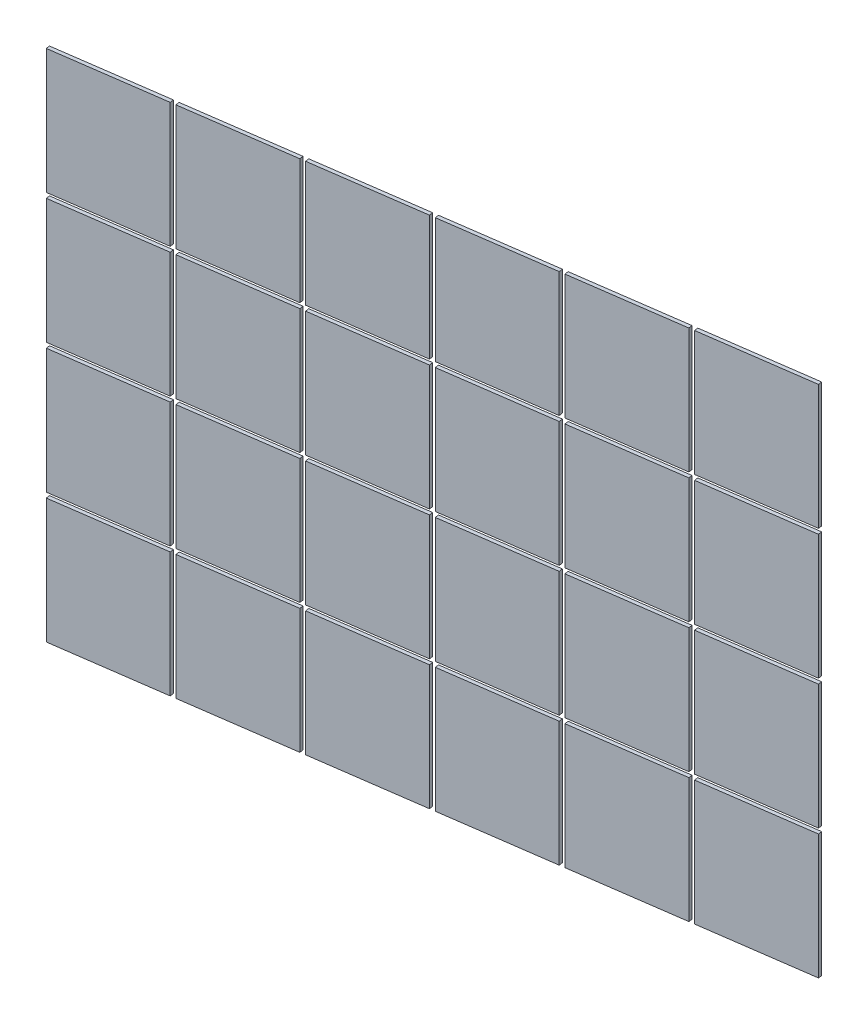
from build123d import *

# Parameters (mm, degrees)
EXTRUDE_START           = 9.3
EXTRUDE_SKETCH_1_W      = 64.666666667
EXTRUDE_SKETCH_1_H      = 73.5
EXTRUDE_1_DEPTH         = 2.2
EXTRUDE_ROTATE_1_ANGLE  = 8
EXTRUDE_SKETCH_2_W      = 64.666666667
EXTRUDE_SKETCH_2_H      = 73.5
EXTRUDE_2_DEPTH         = 2.2
EXTRUDE_ROTATE_2_ANGLE  = 8
EXTRUDE_SKETCH_3_W      = 64.666666667
EXTRUDE_SKETCH_3_H      = 73.5
EXTRUDE_3_DEPTH         = 2.2
EXTRUDE_ROTATE_3_ANGLE  = 8
EXTRUDE_SKETCH_4_W      = 64.666666667
EXTRUDE_SKETCH_4_H      = 73.5
EXTRUDE_4_DEPTH         = 2.2
EXTRUDE_ROTATE_4_ANGLE  = 8
EXTRUDE_SKETCH_5_W      = 64.666666666
EXTRUDE_SKETCH_5_H      = 73.5
EXTRUDE_5_DEPTH         = 2.2
EXTRUDE_ROTATE_5_ANGLE  = 8
EXTRUDE_SKETCH_6_W      = 64.666666666
EXTRUDE_SKETCH_6_H      = 73.5
EXTRUDE_6_DEPTH         = 2.2
EXTRUDE_ROTATE_6_ANGLE  = 8
EXTRUDE_SKETCH_7_W      = 64.666666666
EXTRUDE_SKETCH_7_H      = 73.5
EXTRUDE_7_DEPTH         = 2.2
EXTRUDE_ROTATE_7_ANGLE  = 8
EXTRUDE_SKETCH_8_W      = 64.666666666
EXTRUDE_SKETCH_8_H      = 73.5
EXTRUDE_8_DEPTH         = 2.2
EXTRUDE_ROTATE_8_ANGLE  = 8
EXTRUDE_SKETCH_9_W      = 64.666666667
EXTRUDE_SKETCH_9_H      = 73.5
EXTRUDE_9_DEPTH         = 2.2
EXTRUDE_ROTATE_9_ANGLE  = 8
EXTRUDE_SKETCH_10_W     = 64.666666667
EXTRUDE_SKETCH_10_H     = 73.5
EXTRUDE_10_DEPTH        = 2.2
EXTRUDE_ROTATE_10_ANGLE = 8
EXTRUDE_SKETCH_11_W     = 64.666666667
EXTRUDE_SKETCH_11_H     = 73.5
EXTRUDE_11_DEPTH        = 2.2
EXTRUDE_ROTATE_11_ANGLE = 8
EXTRUDE_SKETCH_12_W     = 64.666666667
EXTRUDE_SKETCH_12_H     = 73.5
EXTRUDE_12_DEPTH        = 2.2
EXTRUDE_ROTATE_12_ANGLE = 8
EXTRUDE_SKETCH_13_W     = 64.666666667
EXTRUDE_SKETCH_13_H     = 73.5
EXTRUDE_13_DEPTH        = 2.2
EXTRUDE_ROTATE_13_ANGLE = 8
EXTRUDE_SKETCH_14_W     = 64.666666667
EXTRUDE_SKETCH_14_H     = 73.5
EXTRUDE_14_DEPTH        = 2.2
EXTRUDE_ROTATE_14_ANGLE = 8
EXTRUDE_SKETCH_15_W     = 64.666666667
EXTRUDE_SKETCH_15_H     = 73.5
EXTRUDE_15_DEPTH        = 2.2
EXTRUDE_ROTATE_15_ANGLE = 8
EXTRUDE_SKETCH_16_W     = 64.666666667
EXTRUDE_SKETCH_16_H     = 73.5
EXTRUDE_16_DEPTH        = 2.2
EXTRUDE_ROTATE_16_ANGLE = 8
EXTRUDE_SKETCH_17_W     = 64.666666666
EXTRUDE_SKETCH_17_H     = 73.5
EXTRUDE_17_DEPTH        = 2.2
EXTRUDE_ROTATE_17_ANGLE = 8
EXTRUDE_SKETCH_18_W     = 64.666666666
EXTRUDE_SKETCH_18_H     = 73.5
EXTRUDE_18_DEPTH        = 2.2
EXTRUDE_ROTATE_18_ANGLE = 8
EXTRUDE_SKETCH_19_W     = 64.666666666
EXTRUDE_SKETCH_19_H     = 73.5
EXTRUDE_19_DEPTH        = 2.2
EXTRUDE_ROTATE_19_ANGLE = 8
EXTRUDE_SKETCH_20_W     = 64.666666666
EXTRUDE_SKETCH_20_H     = 73.5
EXTRUDE_20_DEPTH        = 2.2
EXTRUDE_ROTATE_20_ANGLE = 8
EXTRUDE_SKETCH_21_W     = 64.666666667
EXTRUDE_SKETCH_21_H     = 73.5
EXTRUDE_21_DEPTH        = 2.2
EXTRUDE_ROTATE_21_ANGLE = 8
EXTRUDE_SKETCH_22_W     = 64.666666667
EXTRUDE_SKETCH_22_H     = 73.5
EXTRUDE_22_DEPTH        = 2.2
EXTRUDE_ROTATE_22_ANGLE = 8
EXTRUDE_SKETCH_23_W     = 64.666666667
EXTRUDE_SKETCH_23_H     = 73.5
EXTRUDE_23_DEPTH        = 2.2
EXTRUDE_ROTATE_23_ANGLE = 8
EXTRUDE_SKETCH_24_W     = 64.666666667
EXTRUDE_SKETCH_24_H     = 73.5
EXTRUDE_24_DEPTH        = 2.2
EXTRUDE_ROTATE_24_ANGLE = 8


with BuildPart() as part:
    # Extrude sketch 1 → Extrude 1 (new body)
    with BuildSketch(Plane.XY.offset(EXTRUDE_START)):
        with Locations((-169.166666667, -114.75)):
            Rectangle(EXTRUDE_SKETCH_1_W, EXTRUDE_SKETCH_1_H)
    extrude(amount=EXTRUDE_1_DEPTH)


with BuildPart() as part_1:
    # Extrude rotate 1: moved
    add(part.part.rotate(Axis((0, 0, 0), (0, 1, 0)), EXTRUDE_ROTATE_1_ANGLE))


with BuildPart() as part_2:
    # Extrude place 1: moved
    add(part_1.part.moved(Location((588.929348295, 0, 623.692298575))))


with BuildPart() as body_2:
    # Extrude sketch 2 → Extrude 2 (new body)
    with BuildSketch(Plane.XY.offset(EXTRUDE_START)):
        with Locations((-169.166666667, -38.25)):
            Rectangle(EXTRUDE_SKETCH_2_W, EXTRUDE_SKETCH_2_H)
    extrude(amount=EXTRUDE_2_DEPTH)


with BuildPart() as body_2_1:
    # Extrude rotate 2: moved
    add(body_2.part.rotate(Axis((0, 0, 0), (0, 1, 0)), EXTRUDE_ROTATE_2_ANGLE))


with BuildPart() as body_2_2:
    # Extrude place 2: moved
    add(body_2_1.part.moved(Location((588.929348295, 0, 623.692298575))))


with BuildPart() as body_3:
    # Extrude sketch 3 → Extrude 3 (new body)
    with BuildSketch(Plane.XY.offset(EXTRUDE_START)):
        with Locations((-169.166666667, 38.25)):
            Rectangle(EXTRUDE_SKETCH_3_W, EXTRUDE_SKETCH_3_H)
    extrude(amount=EXTRUDE_3_DEPTH)


with BuildPart() as body_3_1:
    # Extrude rotate 3: moved
    add(body_3.part.rotate(Axis((0, 0, 0), (0, 1, 0)), EXTRUDE_ROTATE_3_ANGLE))


with BuildPart() as body_3_2:
    # Extrude place 3: moved
    add(body_3_1.part.moved(Location((588.929348295, 0, 623.692298575))))


with BuildPart() as body_4:
    # Extrude sketch 4 → Extrude 4 (new body)
    with BuildSketch(Plane.XY.offset(EXTRUDE_START)):
        with Locations((-169.166666667, 114.75)):
            Rectangle(EXTRUDE_SKETCH_4_W, EXTRUDE_SKETCH_4_H)
    extrude(amount=EXTRUDE_4_DEPTH)


with BuildPart() as body_4_1:
    # Extrude rotate 4: moved
    add(body_4.part.rotate(Axis((0, 0, 0), (0, 1, 0)), EXTRUDE_ROTATE_4_ANGLE))


with BuildPart() as body_4_2:
    # Extrude place 4: moved
    add(body_4_1.part.moved(Location((588.929348295, 0, 623.692298575))))


with BuildPart() as body_5:
    # Extrude sketch 5 → Extrude 5 (new body)
    with BuildSketch(Plane.XY.offset(EXTRUDE_START)):
        with Locations((-101.5, -114.75)):
            Rectangle(EXTRUDE_SKETCH_5_W, EXTRUDE_SKETCH_5_H)
    extrude(amount=EXTRUDE_5_DEPTH)


with BuildPart() as body_5_1:
    # Extrude rotate 5: moved
    add(body_5.part.rotate(Axis((0, 0, 0), (0, 1, 0)), EXTRUDE_ROTATE_5_ANGLE))


with BuildPart() as body_5_2:
    # Extrude place 5: moved
    add(body_5_1.part.moved(Location((588.929348295, 0, 623.692298575))))


with BuildPart() as body_6:
    # Extrude sketch 6 → Extrude 6 (new body)
    with BuildSketch(Plane.XY.offset(EXTRUDE_START)):
        with Locations((-101.5, -38.25)):
            Rectangle(EXTRUDE_SKETCH_6_W, EXTRUDE_SKETCH_6_H)
    extrude(amount=EXTRUDE_6_DEPTH)


with BuildPart() as body_6_1:
    # Extrude rotate 6: moved
    add(body_6.part.rotate(Axis((0, 0, 0), (0, 1, 0)), EXTRUDE_ROTATE_6_ANGLE))


with BuildPart() as body_6_2:
    # Extrude place 6: moved
    add(body_6_1.part.moved(Location((588.929348295, 0, 623.692298575))))


with BuildPart() as body_7:
    # Extrude sketch 7 → Extrude 7 (new body)
    with BuildSketch(Plane.XY.offset(EXTRUDE_START)):
        with Locations((-101.5, 38.25)):
            Rectangle(EXTRUDE_SKETCH_7_W, EXTRUDE_SKETCH_7_H)
    extrude(amount=EXTRUDE_7_DEPTH)


with BuildPart() as body_7_1:
    # Extrude rotate 7: moved
    add(body_7.part.rotate(Axis((0, 0, 0), (0, 1, 0)), EXTRUDE_ROTATE_7_ANGLE))


with BuildPart() as body_7_2:
    # Extrude place 7: moved
    add(body_7_1.part.moved(Location((588.929348295, 0, 623.692298575))))


with BuildPart() as body_8:
    # Extrude sketch 8 → Extrude 8 (new body)
    with BuildSketch(Plane.XY.offset(EXTRUDE_START)):
        with Locations((-101.5, 114.75)):
            Rectangle(EXTRUDE_SKETCH_8_W, EXTRUDE_SKETCH_8_H)
    extrude(amount=EXTRUDE_8_DEPTH)


with BuildPart() as body_8_1:
    # Extrude rotate 8: moved
    add(body_8.part.rotate(Axis((0, 0, 0), (0, 1, 0)), EXTRUDE_ROTATE_8_ANGLE))


with BuildPart() as body_8_2:
    # Extrude place 8: moved
    add(body_8_1.part.moved(Location((588.929348295, 0, 623.692298575))))


with BuildPart() as body_9:
    # Extrude sketch 9 → Extrude 9 (new body)
    with BuildSketch(Plane.XY.offset(EXTRUDE_START)):
        with Locations((-33.833333334, -114.75)):
            Rectangle(EXTRUDE_SKETCH_9_W, EXTRUDE_SKETCH_9_H)
    extrude(amount=EXTRUDE_9_DEPTH)


with BuildPart() as body_9_1:
    # Extrude rotate 9: moved
    add(body_9.part.rotate(Axis((0, 0, 0), (0, 1, 0)), EXTRUDE_ROTATE_9_ANGLE))


with BuildPart() as body_9_2:
    # Extrude place 9: moved
    add(body_9_1.part.moved(Location((588.929348295, 0, 623.692298575))))


with BuildPart() as body_10:
    # Extrude sketch 10 → Extrude 10 (new body)
    with BuildSketch(Plane.XY.offset(EXTRUDE_START)):
        with Locations((-33.833333334, -38.25)):
            Rectangle(EXTRUDE_SKETCH_10_W, EXTRUDE_SKETCH_10_H)
    extrude(amount=EXTRUDE_10_DEPTH)


with BuildPart() as body_10_1:
    # Extrude rotate 10: moved
    add(body_10.part.rotate(Axis((0, 0, 0), (0, 1, 0)), EXTRUDE_ROTATE_10_ANGLE))


with BuildPart() as body_10_2:
    # Extrude place 10: moved
    add(body_10_1.part.moved(Location((588.929348295, 0, 623.692298575))))


with BuildPart() as body_11:
    # Extrude sketch 11 → Extrude 11 (new body)
    with BuildSketch(Plane.XY.offset(EXTRUDE_START)):
        with Locations((-33.833333334, 38.25)):
            Rectangle(EXTRUDE_SKETCH_11_W, EXTRUDE_SKETCH_11_H)
    extrude(amount=EXTRUDE_11_DEPTH)


with BuildPart() as body_11_1:
    # Extrude rotate 11: moved
    add(body_11.part.rotate(Axis((0, 0, 0), (0, 1, 0)), EXTRUDE_ROTATE_11_ANGLE))


with BuildPart() as body_11_2:
    # Extrude place 11: moved
    add(body_11_1.part.moved(Location((588.929348295, 0, 623.692298575))))


with BuildPart() as body_12:
    # Extrude sketch 12 → Extrude 12 (new body)
    with BuildSketch(Plane.XY.offset(EXTRUDE_START)):
        with Locations((-33.833333334, 114.75)):
            Rectangle(EXTRUDE_SKETCH_12_W, EXTRUDE_SKETCH_12_H)
    extrude(amount=EXTRUDE_12_DEPTH)


with BuildPart() as body_12_1:
    # Extrude rotate 12: moved
    add(body_12.part.rotate(Axis((0, 0, 0), (0, 1, 0)), EXTRUDE_ROTATE_12_ANGLE))


with BuildPart() as body_12_2:
    # Extrude place 12: moved
    add(body_12_1.part.moved(Location((588.929348295, 0, 623.692298575))))


with BuildPart() as body_13:
    # Extrude sketch 13 → Extrude 13 (new body)
    with BuildSketch(Plane.XY.offset(EXTRUDE_START)):
        with Locations((33.833333334, -114.75)):
            Rectangle(EXTRUDE_SKETCH_13_W, EXTRUDE_SKETCH_13_H)
    extrude(amount=EXTRUDE_13_DEPTH)


with BuildPart() as body_13_1:
    # Extrude rotate 13: moved
    add(body_13.part.rotate(Axis((0, 0, 0), (0, 1, 0)), EXTRUDE_ROTATE_13_ANGLE))


with BuildPart() as body_13_2:
    # Extrude place 13: moved
    add(body_13_1.part.moved(Location((588.929348295, 0, 623.692298575))))


with BuildPart() as body_14:
    # Extrude sketch 14 → Extrude 14 (new body)
    with BuildSketch(Plane.XY.offset(EXTRUDE_START)):
        with Locations((33.833333334, -38.25)):
            Rectangle(EXTRUDE_SKETCH_14_W, EXTRUDE_SKETCH_14_H)
    extrude(amount=EXTRUDE_14_DEPTH)


with BuildPart() as body_14_1:
    # Extrude rotate 14: moved
    add(body_14.part.rotate(Axis((0, 0, 0), (0, 1, 0)), EXTRUDE_ROTATE_14_ANGLE))


with BuildPart() as body_14_2:
    # Extrude place 14: moved
    add(body_14_1.part.moved(Location((588.929348295, 0, 623.692298575))))


with BuildPart() as body_15:
    # Extrude sketch 15 → Extrude 15 (new body)
    with BuildSketch(Plane.XY.offset(EXTRUDE_START)):
        with Locations((33.833333334, 38.25)):
            Rectangle(EXTRUDE_SKETCH_15_W, EXTRUDE_SKETCH_15_H)
    extrude(amount=EXTRUDE_15_DEPTH)


with BuildPart() as body_15_1:
    # Extrude rotate 15: moved
    add(body_15.part.rotate(Axis((0, 0, 0), (0, 1, 0)), EXTRUDE_ROTATE_15_ANGLE))


with BuildPart() as body_15_2:
    # Extrude place 15: moved
    add(body_15_1.part.moved(Location((588.929348295, 0, 623.692298575))))


with BuildPart() as body_16:
    # Extrude sketch 16 → Extrude 16 (new body)
    with BuildSketch(Plane.XY.offset(EXTRUDE_START)):
        with Locations((33.833333334, 114.75)):
            Rectangle(EXTRUDE_SKETCH_16_W, EXTRUDE_SKETCH_16_H)
    extrude(amount=EXTRUDE_16_DEPTH)


with BuildPart() as body_16_1:
    # Extrude rotate 16: moved
    add(body_16.part.rotate(Axis((0, 0, 0), (0, 1, 0)), EXTRUDE_ROTATE_16_ANGLE))


with BuildPart() as body_16_2:
    # Extrude place 16: moved
    add(body_16_1.part.moved(Location((588.929348295, 0, 623.692298575))))


with BuildPart() as body_17:
    # Extrude sketch 17 → Extrude 17 (new body)
    with BuildSketch(Plane.XY.offset(EXTRUDE_START)):
        with Locations((101.5, -114.75)):
            Rectangle(EXTRUDE_SKETCH_17_W, EXTRUDE_SKETCH_17_H)
    extrude(amount=EXTRUDE_17_DEPTH)


with BuildPart() as body_17_1:
    # Extrude rotate 17: moved
    add(body_17.part.rotate(Axis((0, 0, 0), (0, 1, 0)), EXTRUDE_ROTATE_17_ANGLE))


with BuildPart() as body_17_2:
    # Extrude place 17: moved
    add(body_17_1.part.moved(Location((588.929348295, 0, 623.692298575))))


with BuildPart() as body_18:
    # Extrude sketch 18 → Extrude 18 (new body)
    with BuildSketch(Plane.XY.offset(EXTRUDE_START)):
        with Locations((101.5, -38.25)):
            Rectangle(EXTRUDE_SKETCH_18_W, EXTRUDE_SKETCH_18_H)
    extrude(amount=EXTRUDE_18_DEPTH)


with BuildPart() as body_18_1:
    # Extrude rotate 18: moved
    add(body_18.part.rotate(Axis((0, 0, 0), (0, 1, 0)), EXTRUDE_ROTATE_18_ANGLE))


with BuildPart() as body_18_2:
    # Extrude place 18: moved
    add(body_18_1.part.moved(Location((588.929348295, 0, 623.692298575))))


with BuildPart() as body_19:
    # Extrude sketch 19 → Extrude 19 (new body)
    with BuildSketch(Plane.XY.offset(EXTRUDE_START)):
        with Locations((101.5, 38.25)):
            Rectangle(EXTRUDE_SKETCH_19_W, EXTRUDE_SKETCH_19_H)
    extrude(amount=EXTRUDE_19_DEPTH)


with BuildPart() as body_19_1:
    # Extrude rotate 19: moved
    add(body_19.part.rotate(Axis((0, 0, 0), (0, 1, 0)), EXTRUDE_ROTATE_19_ANGLE))


with BuildPart() as body_19_2:
    # Extrude place 19: moved
    add(body_19_1.part.moved(Location((588.929348295, 0, 623.692298575))))


with BuildPart() as body_20:
    # Extrude sketch 20 → Extrude 20 (new body)
    with BuildSketch(Plane.XY.offset(EXTRUDE_START)):
        with Locations((101.5, 114.75)):
            Rectangle(EXTRUDE_SKETCH_20_W, EXTRUDE_SKETCH_20_H)
    extrude(amount=EXTRUDE_20_DEPTH)


with BuildPart() as body_20_1:
    # Extrude rotate 20: moved
    add(body_20.part.rotate(Axis((0, 0, 0), (0, 1, 0)), EXTRUDE_ROTATE_20_ANGLE))


with BuildPart() as body_20_2:
    # Extrude place 20: moved
    add(body_20_1.part.moved(Location((588.929348295, 0, 623.692298575))))


with BuildPart() as body_21:
    # Extrude sketch 21 → Extrude 21 (new body)
    with BuildSketch(Plane.XY.offset(EXTRUDE_START)):
        with Locations((169.166666667, -114.75)):
            Rectangle(EXTRUDE_SKETCH_21_W, EXTRUDE_SKETCH_21_H)
    extrude(amount=EXTRUDE_21_DEPTH)


with BuildPart() as body_21_1:
    # Extrude rotate 21: moved
    add(body_21.part.rotate(Axis((0, 0, 0), (0, 1, 0)), EXTRUDE_ROTATE_21_ANGLE))


with BuildPart() as body_21_2:
    # Extrude place 21: moved
    add(body_21_1.part.moved(Location((588.929348295, 0, 623.692298575))))


with BuildPart() as body_22:
    # Extrude sketch 22 → Extrude 22 (new body)
    with BuildSketch(Plane.XY.offset(EXTRUDE_START)):
        with Locations((169.166666667, -38.25)):
            Rectangle(EXTRUDE_SKETCH_22_W, EXTRUDE_SKETCH_22_H)
    extrude(amount=EXTRUDE_22_DEPTH)


with BuildPart() as body_22_1:
    # Extrude rotate 22: moved
    add(body_22.part.rotate(Axis((0, 0, 0), (0, 1, 0)), EXTRUDE_ROTATE_22_ANGLE))


with BuildPart() as body_22_2:
    # Extrude place 22: moved
    add(body_22_1.part.moved(Location((588.929348295, 0, 623.692298575))))


with BuildPart() as body_23:
    # Extrude sketch 23 → Extrude 23 (new body)
    with BuildSketch(Plane.XY.offset(EXTRUDE_START)):
        with Locations((169.166666667, 38.25)):
            Rectangle(EXTRUDE_SKETCH_23_W, EXTRUDE_SKETCH_23_H)
    extrude(amount=EXTRUDE_23_DEPTH)


with BuildPart() as body_23_1:
    # Extrude rotate 23: moved
    add(body_23.part.rotate(Axis((0, 0, 0), (0, 1, 0)), EXTRUDE_ROTATE_23_ANGLE))


with BuildPart() as body_23_2:
    # Extrude place 23: moved
    add(body_23_1.part.moved(Location((588.929348295, 0, 623.692298575))))


with BuildPart() as body_24:
    # Extrude sketch 24 → Extrude 24 (new body)
    with BuildSketch(Plane.XY.offset(EXTRUDE_START)):
        with Locations((169.166666667, 114.75)):
            Rectangle(EXTRUDE_SKETCH_24_W, EXTRUDE_SKETCH_24_H)
    extrude(amount=EXTRUDE_24_DEPTH)


with BuildPart() as body_24_1:
    # Extrude rotate 24: moved
    add(body_24.part.rotate(Axis((0, 0, 0), (0, 1, 0)), EXTRUDE_ROTATE_24_ANGLE))


with BuildPart() as body_24_2:
    # Extrude place 24: moved
    add(body_24_1.part.moved(Location((588.929348295, 0, 623.692298575))))


solid = Compound([part_2.part, body_2_2.part, body_3_2.part, body_4_2.part, body_5_2.part, body_6_2.part, body_7_2.part, body_8_2.part, body_9_2.part, body_10_2.part, body_11_2.part, body_12_2.part, body_13_2.part, body_14_2.part, body_15_2.part, body_16_2.part, body_17_2.part, body_18_2.part, body_19_2.part, body_20_2.part, body_21_2.part, body_22_2.part, body_23_2.part, body_24_2.part])
